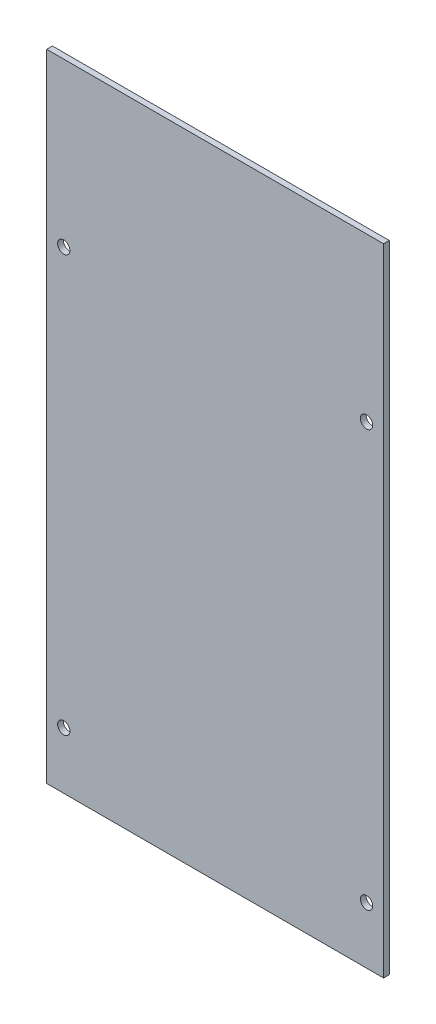
from build123d import *

# Parameters (mm, degrees)
SKETCH1_W               = 178
SKETCH1_H               = 336
BOSS_EXTRUDE1_DEPTH     = 3
CUT_EXTRUDE1_DEPTH      = 348.600345224
CUT_EXTRUDE1_DEPTH_BACK = 348.600345224
SKETCH2_R               = 3.25


with BuildPart() as part:
    # Sketch1 → Boss-Extrude1 (new body)
    with BuildSketch(Plane.XY):
        with Locations((0, 168)):
            Rectangle(SKETCH1_W, SKETCH1_H)
    extrude(amount=BOSS_EXTRUDE1_DEPTH)

    # Sketch2 → Cut-Extrude1 (cut, two sides: drawn at the far end of the back side and taken through both)
    with BuildSketch(Plane.XY.offset(3).offset(-CUT_EXTRUDE1_DEPTH_BACK)):
        with Locations((-80, 250)):
            Circle(SKETCH2_R)
        with Locations((80, 250)):
            Circle(SKETCH2_R)
        with Locations((80, 30)):
            Circle(SKETCH2_R)
        with Locations((-80, 30)):
            Circle(SKETCH2_R)
    extrude(amount=CUT_EXTRUDE1_DEPTH + CUT_EXTRUDE1_DEPTH_BACK, mode=Mode.SUBTRACT)


solid = part.part
